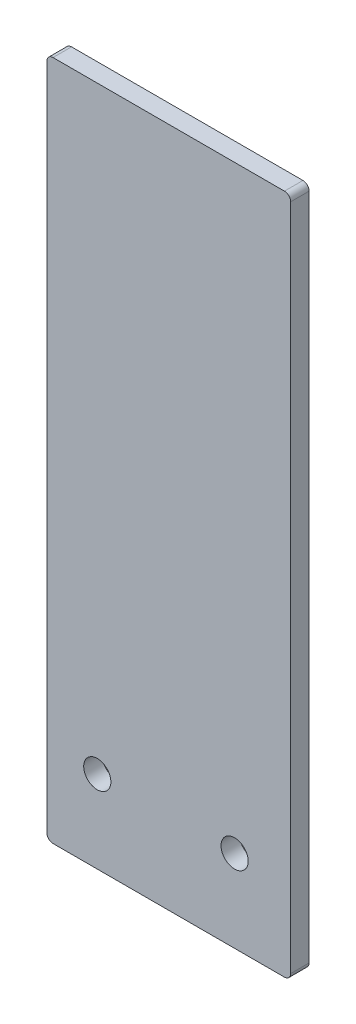
from build123d import *

# Parameters (mm, degrees)
ESQUISSE2_R        = 1.1
BOSS_EXTRU_1_DEPTH = 1.5


with BuildPart() as part:
    # Esquisse2 → Boss.-Extru.1 (new body)
    with BuildSketch(Plane.XY):
        with BuildLine():
            Line((32.261843, -158.490889), (32.261843, -212.640891272))
            ThreePointArc((32.261843, -212.640891272), (32.408289609, -212.994444663), (32.761843, -213.140891272))
            Line((32.761843, -213.140891272), (51.512148163, -213.140891272))
            ThreePointArc((51.512148163, -213.140891272), (51.865701554, -212.994444663), (52.012148163, -212.640891272))
            Line((52.012148163, -212.640891272), (52.012148163, -158.490889))
            ThreePointArc((52.012148163, -158.490889), (51.865701554, -158.137335609), (51.512148163, -157.990889))
            Line((51.512148163, -157.990889), (32.761843, -157.990889))
            ThreePointArc((32.761843, -157.990889), (32.408289609, -158.137335609), (32.261843, -158.490889))
        make_face()
        with Locations((36.3474, -206.4766)):
            Circle(ESQUISSE2_R, mode=Mode.SUBTRACT)
        with Locations((47.4726, -206.4766)):
            Circle(ESQUISSE2_R, mode=Mode.SUBTRACT)
    extrude(amount=BOSS_EXTRU_1_DEPTH)


solid = part.part
